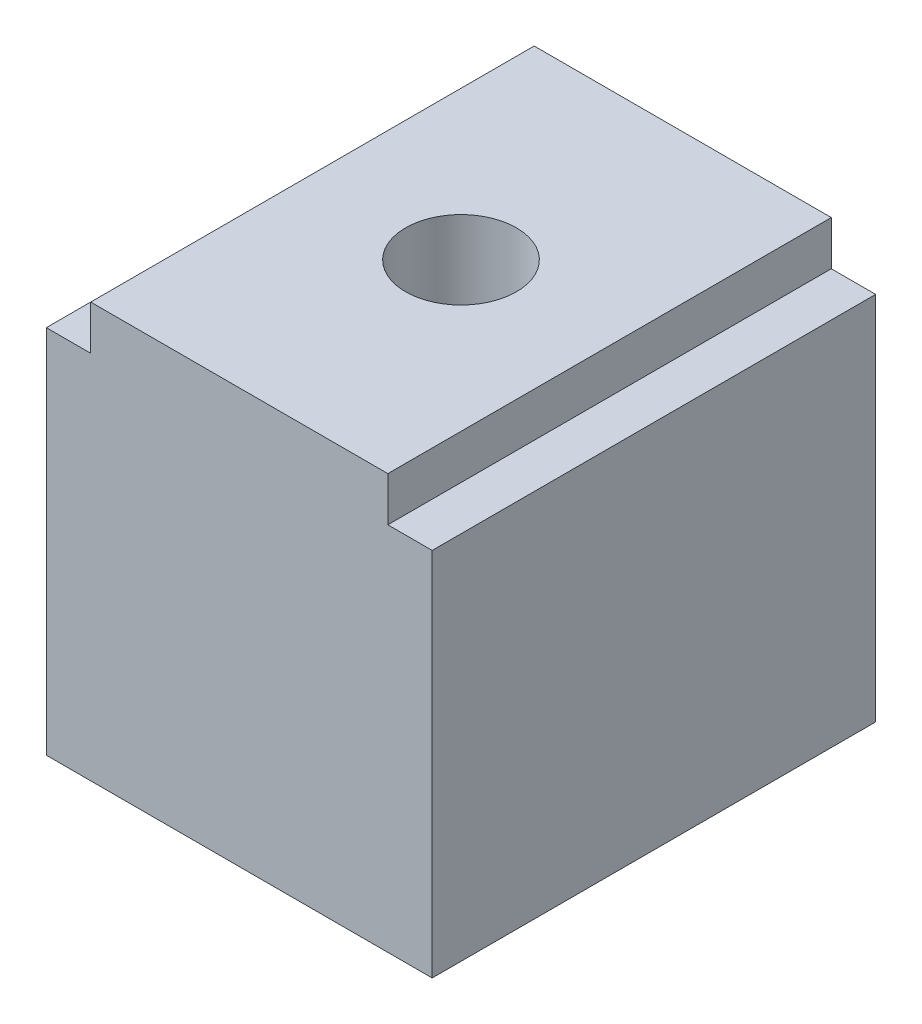
from build123d import *

# Parameters (mm, degrees)
SKETCH1_W           = 22.098
SKETCH1_H           = 25.4
SKETCH1_R           = 3.175
BOSS_EXTRUDE1_DEPTH = 23.749
SKETCH3_W           = 2.54
SKETCH3_H           = 25.4
CUT_EXTRUDE2_DEPTH  = 2.54


with BuildPart() as part:
    # Sketch1 → Boss-Extrude1 (new body)
    with BuildSketch(Plane(origin=(0, 0, 0), x_dir=(1, 0, 0), z_dir=(0, 1, 0))):
        Rectangle(SKETCH1_W, SKETCH1_H)
        with Locations(Location((0, 0, 0), (0, 0, 90))):
            Circle(SKETCH1_R, mode=Mode.SUBTRACT)
    extrude(amount=BOSS_EXTRUDE1_DEPTH)

    # Sketch3 → Cut-Extrude2 (cut)
    with BuildSketch(Plane(origin=(0, 23.749, 0), x_dir=(1, 0, 0), z_dir=(0, 1, 0))):
        with Locations((9.779, 0)):
            Rectangle(SKETCH3_W, SKETCH3_H)
        with Locations((-9.779, 0)):
            Rectangle(SKETCH3_W, SKETCH3_H)
    extrude(amount=-CUT_EXTRUDE2_DEPTH, mode=Mode.SUBTRACT)


solid = part.part
